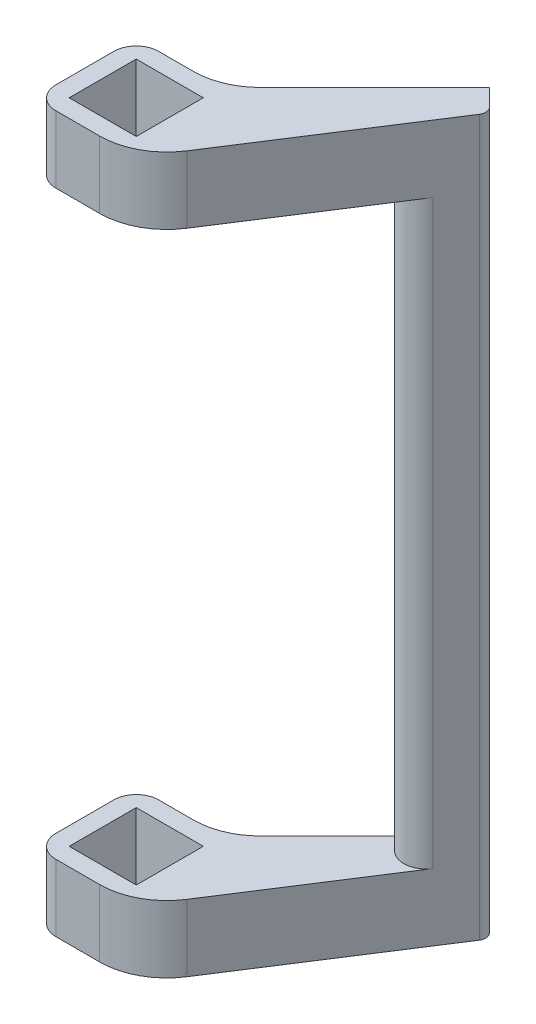
from build123d import *

# Parameters (mm, degrees)
SKETCH_1_W          = 15.000000000000002
SKETCH_1_H          = 15
EXTRUDE_1_DEPTH     = 160
CUT_EXTRUDE_2_DEPTH = 35
FILLET_3_R          = 5
FILLET_4_R          = 5
FILLET_6_R          = 15
FILLET_7_R          = 15
FILLET_8_R          = 15
FILLET_9_R          = 15
EXTRUDE_2_DEPTH     = 159
FILLET_10_R         = 5
FILLET_11_R         = 2


with BuildPart() as part:
    # 草图1 → 凸台-拉伸1 (new body)
    with BuildSketch(Plane(origin=(0, 0, 0), x_dir=(1, 0, 0), z_dir=(0, 1, 0))):
        Polygon((-11.5, 11.500000000000002), (7.5, 11.500000000000002), (37.49999999999999, 41.49999999999999), (42.44974746830583, 36.550252531694156), (11.5, -11.5), (-11.5, -11.5), align=None)
        Rectangle(SKETCH_1_W, SKETCH_1_H, mode=Mode.SUBTRACT)
    extrude(amount=EXTRUDE_1_DEPTH)

    # 草图4 → 切除-拉伸2 (cut, symmetric)
    with BuildSketch(Plane(origin=(0, 0, -11.500000000000002), x_dir=(-1, 0, 0), z_dir=(0, 0, -1))):
        Polygon((-62.54884054332868, 145.00000000000003), (52.803582628705634, 145.00000000000003), (52.80358262870564, 15), (-62.548840543328666, 15), align=None)
    extrude(amount=CUT_EXTRUDE_2_DEPTH, both=True, mode=Mode.SUBTRACT)


with BuildPart() as cut_extrude_2_piece_1:
    # of the separate pieces the step leaves, piece 1, a body of its own (cut_extrude_2_pieces)
    add(part.part.solids().sort_by_distance((-11.5, 0, -11.5))[0])

    # 圆角4
    fillet_4_edges = [cut_extrude_2_piece_1.edges().sort_by_distance(p)[0] for p in [
        (-11.5, 7.5, 11.5),
        (-11.5, 7.5, -11.500000000000002),
    ]]
    fillet(fillet_4_edges, radius=FILLET_4_R)

    # 圆角7
    fillet_7_edges = [cut_extrude_2_piece_1.edges().sort_by_distance(p)[0] for p in [
        (11.5, 7.5, 11.5),
    ]]
    fillet(fillet_7_edges, radius=FILLET_7_R)

    # 圆角8
    fillet_8_edges = [cut_extrude_2_piece_1.edges().sort_by_distance(p)[0] for p in [
        (7.5, 7.5, -11.500000000000002),
    ]]
    fillet(fillet_8_edges, radius=FILLET_8_R)



with BuildPart() as cut_extrude_2_piece_2:
    # of the separate pieces the step leaves, piece 2, a body of its own (cut_extrude_2_pieces)
    add(part.part.solids().sort_by_distance((7.5, 145, -11.5))[0])

    # 圆角3
    fillet_3_edges = [cut_extrude_2_piece_2.edges().sort_by_distance(p)[0] for p in [
        (-11.5, 152.5, -11.500000000000002),
        (-11.5, 152.5, 11.5),
    ]]
    fillet(fillet_3_edges, radius=FILLET_3_R)

    # 圆角6
    fillet_6_edges = [cut_extrude_2_piece_2.edges().sort_by_distance(p)[0] for p in [
        (11.5, 152.5, 11.5),
    ]]
    fillet(fillet_6_edges, radius=FILLET_6_R)

    # 圆角9
    fillet_9_edges = [cut_extrude_2_piece_2.edges().sort_by_distance(p)[0] for p in [
        (7.5, 152.5, -11.500000000000002),
    ]]
    fillet(fillet_9_edges, radius=FILLET_9_R)


with BuildPart() as cut_extrude_2_piece_1_1:
    add(cut_extrude_2_piece_1.part)

    add(cut_extrude_2_piece_2.part)  # 凸台-拉伸2 merges 切除-拉伸2 piece 2
    # 草图6 → 凸台-拉伸2 (add)
    with BuildSketch(Plane.XZ):
        Polygon((29.72182540693865, -28.064971157451247), (34.139072919876334, -23.647723644513547), (42.44974746830049, -36.550252531685864), (40.328427124736876, -38.671572875249474), align=None)
    extrude(amount=-EXTRUDE_2_DEPTH)

    # 圆角10
    fillet_10_edges = [cut_extrude_2_piece_1_1.edges().sort_by_distance(p)[0] for p in [
        (34.139072919876334, 80.00000000000003, -23.647723644513547),
    ]]
    fillet(fillet_10_edges, radius=FILLET_10_R)

    # 圆角11
    fillet_11_edges = [cut_extrude_2_piece_1_1.edges().sort_by_distance(p)[0] for p in [
        (42.449747468304494, 80, -36.55025253169208),
    ]]
    fillet(fillet_11_edges, radius=FILLET_11_R)


solid = cut_extrude_2_piece_1_1.part
